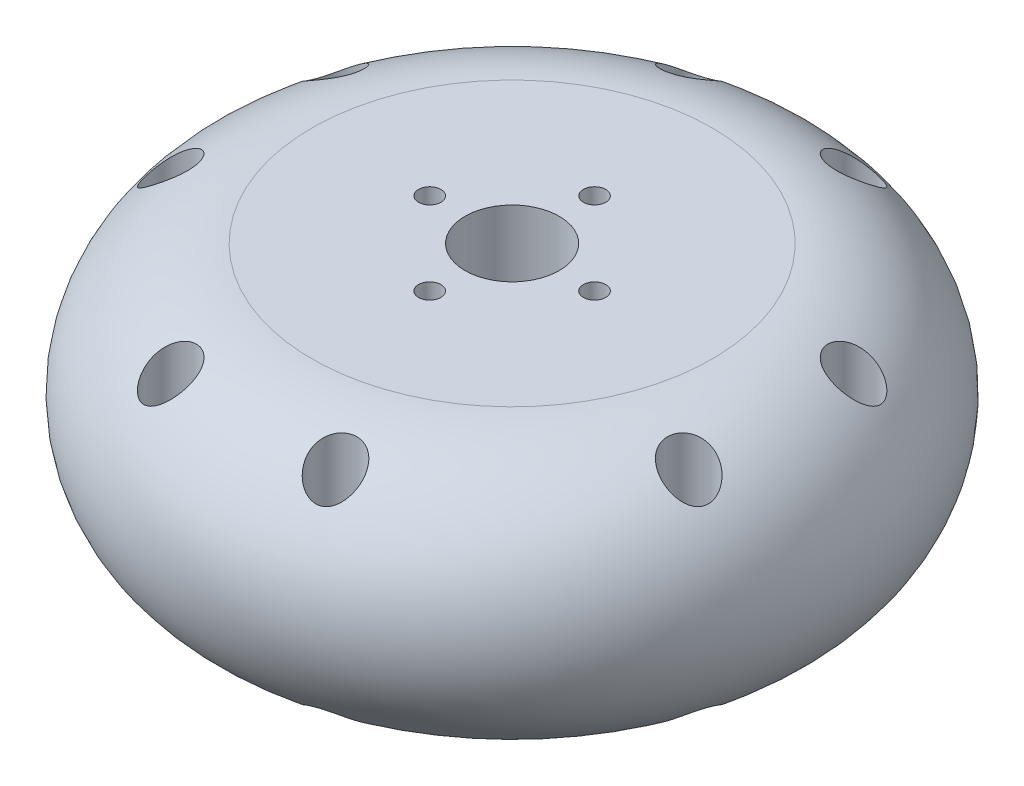
from build123d import *
from build123d.topology import SkipClean

# Parameters (mm, degrees)
SKETCH2_R          = 2
CUT_EXTRUDE1_DEPTH = 46.299006735
CIRPATTERN1_COUNT  = 4
SKETCH3_R          = 0.95
CUT_EXTRUDE2_DEPTH = 5
CIRPATTERN2_COUNT  = 4
SKETCH4_R          = 4
CUT_EXTRUDE3_DEPTH = 46.299006784


with BuildPart() as part:
    # Sketch1 → Revolve2 (revolve)
    with BuildSketch(Plane.XY, mode=Mode.PRIVATE) as revolve2_sk:
        with BuildLine():
            Line((0, 0), (-17, 0))
            ThreePointArc((-17, 0), (-28, -11), (-17, -22))
            Line((-17, -22), (0, -22))
            Line((0, -22), (0, 0))
        make_face()
    revolve(revolve2_sk.sketch.rotate(Axis((0, -22, 0), (0, 1, 0)), 270), axis=Axis((0, -22, 0), (0, 1, 0)))

    # Sketch2 → Cut-Extrude1 (cut, through all)
    with SkipClean():  # the faces are left unmerged after this step: merging them gives an invalid solid
        with BuildSketch(Plane(origin=(0, 0, 0), x_dir=(1, 0, 0), z_dir=(0, 1, 0))):
            with Locations(Location((7, 22, 0), (0, 0, 171.31326608))):
                Circle(SKETCH2_R)
            with Locations(Location((-7, 22, 0), (0, 0, 132.600597515))):
                Circle(SKETCH2_R)
        cut_extrude1 = extrude(amount=-CUT_EXTRUDE1_DEPTH, mode=Mode.SUBTRACT)

    # CirPattern1: Cut-Extrude1 ×4 about axis
    with SkipClean():  # the faces are left unmerged after this step: merging them gives an invalid solid
        cirpattern1_axis = Axis((0, 0, 0), (0, 1, 0))
        for i in range(1, CIRPATTERN1_COUNT):
            add(cut_extrude1.rotate(cirpattern1_axis, i * 360 / CIRPATTERN1_COUNT), mode=Mode.SUBTRACT)

    # Sketch3 → Cut-Extrude2 (cut)
    with SkipClean():  # the faces are left unmerged after this step: merging them gives an invalid solid
        with BuildSketch(Plane(origin=(0, 0, 0), x_dir=(1, 0, 0), z_dir=(0, 1, 0))):
            with Locations(Location((7, 0, 0), (0, 0, 270))):
                Circle(SKETCH3_R)
        cut_extrude2 = extrude(amount=-CUT_EXTRUDE2_DEPTH, mode=Mode.SUBTRACT)

    # CirPattern2: Cut-Extrude2 ×4 about axis
    with SkipClean():  # the faces are left unmerged after this step: merging them gives an invalid solid
        cirpattern2_axis = Axis((0, 0, 0), (0, 1, 0))
        for i in range(1, CIRPATTERN2_COUNT):
            add(cut_extrude2.rotate(cirpattern2_axis, i * 360 / CIRPATTERN2_COUNT), mode=Mode.SUBTRACT)

    # Sketch4 → Cut-Extrude3 (cut, through all)
    with SkipClean():  # the faces are left unmerged after this step: merging them gives an invalid solid
        with BuildSketch(Plane(origin=(0, 0, 0), x_dir=(1, 0, 0), z_dir=(0, 1, 0))):
            with Locations(Location((0, 0, 0), (0, 0, 270))):
                Circle(SKETCH4_R)
        extrude(amount=-CUT_EXTRUDE3_DEPTH, mode=Mode.SUBTRACT)


solid = part.part
